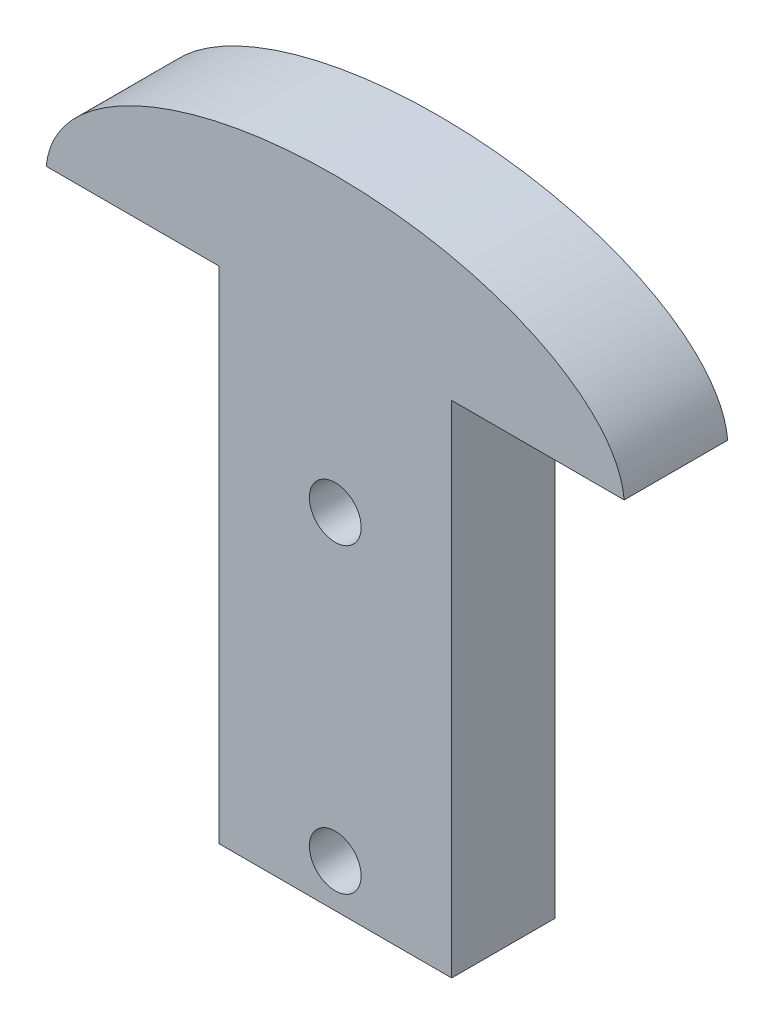
from build123d import *

# Parameters (mm, degrees)
ESBO_O1_R                = 1.5
RESSALTO_EXTRUS_O1_DEPTH = 6


with BuildPart() as part:
    # Esboço1 → Ressalto-extrusão1 (new body)
    with BuildSketch(Plane.XY):
        with BuildLine():
            Line((-6.75, 14.75), (-6.75, -14.25))
            Line((-6.75, -14.25), (6.75, -14.25))
            Line((6.75, -14.25), (6.75, 14.75))
            Line((6.75, 14.75), (16.75, 14.75))
            add(Edge.make_bspline(
                [(16.75, 14.75), (16.073167379, 22.667886976), (0.00460029, 22.667886976), (-16.0639668, 22.667886976), (-16.75, 14.75)],
                knots=[0.042041887, 0.042041887, 0.042041887, 1.570417671, 1.570417671, 3.098793456, 3.098793456, 3.098793456], degree=2, weights=[1, 0.721944534, 1, 0.721944534, 1]))
            Line((-16.75, 14.75), (-6.75, 14.75))
        make_face()
        with Locations((0, -11.75)):
            Circle(ESBO_O1_R, mode=Mode.SUBTRACT)
        with Locations((0, 5.75)):
            Circle(ESBO_O1_R, mode=Mode.SUBTRACT)
    extrude(amount=RESSALTO_EXTRUS_O1_DEPTH)


solid = part.part
